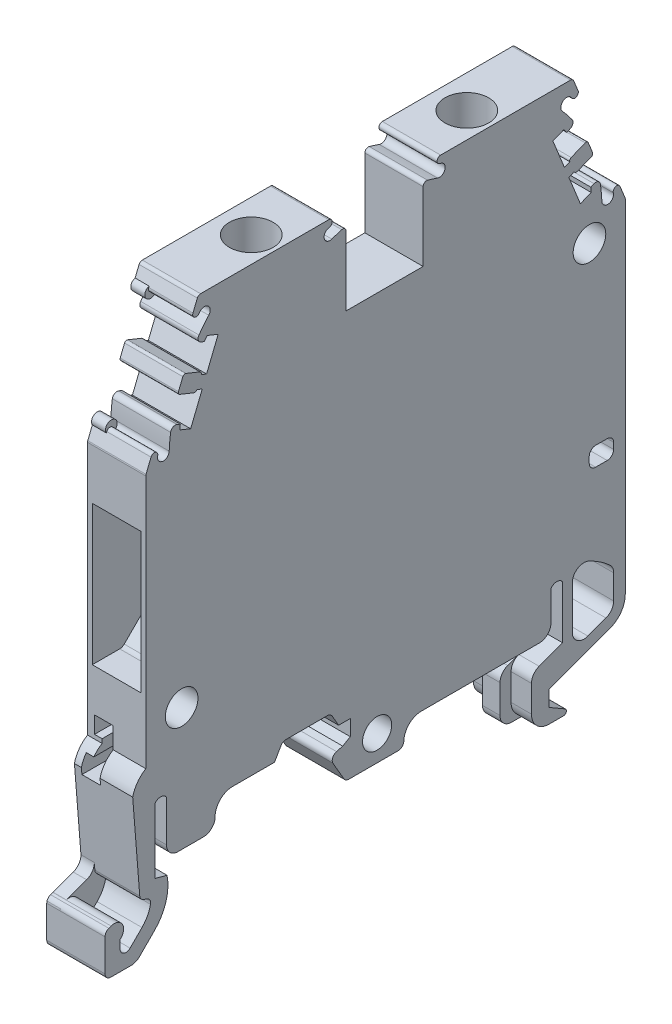
from build123d import *

# Parameters (mm, degrees)
EXTRUDE1_DEPTH      = 5
EXTRUDE2_DEPTH      = 5
SKETCH3_R           = 1.4
EXTRUDE3_DEPTH      = 2.3
SKETCH4_R           = 1.4
EXTRUDE4_DEPTH      = 3.5
EXTRUDE5_DEPTH      = 1.15
EXTRUDE6_DEPTH      = 5
EXTRUDE6_DEPTH_BACK = 5
SKETCH6_R           = 1.25
EXTRUDE7_DEPTH      = 4
EXTRUDE8_DEPTH      = 1.5
SKETCH11_R          = 0.5
EXTRUDE9_DEPTH      = 1.2
SKETCH12_R          = 0.5
EXTRUDE10_DEPTH     = 1.2
SKETCH13_R          = 0.5
EXTRUDE11_DEPTH     = 1.2
SKETCH14_R          = 0.5
EXTRUDE12_DEPTH     = 1.2
EXTRUDE13_DEPTH     = 4.17
EXTRUDE14_DEPTH     = 4.17
EXTRUDE15_DEPTH     = 16.5
EXTRUDE16_DEPTH     = 5.442
EXTRUDE17_START     = -16.5
EXTRUDE17_DEPTH     = 16.5
EXTRUDE18_DEPTH     = 5.588
EXTRUDE19_DEPTH     = 2


with BuildPart() as part:
    # Sketch1 → Extrude1 (new body)
    with BuildSketch(Plane(origin=(0, 0, 0), x_dir=(0, 0, -1), z_dir=(1, 0, 0))):
        with BuildLine():
            Line((-23.502, -46.95), (-21.759, -46.95))
            ThreePointArc((-21.759, -46.95), (-21.376323502, -46.873882406), (-21.051946609, -46.657053391))
            Line((-21.051946609, -46.657053391), (-19.773286438, -45.378213562))
            ThreePointArc((-19.773286438, -45.378213562), (-18.776475564, -43.718487394), (-18.675825444, -41.785046827))
            Line((-18.675825444, -41.785046827), (-19.727, -41.503053653))
            Line((-19.727, -41.503053653), (-19.727, -35.95))
            ThreePointArc((-19.727, -35.95), (-19.227, -35.681662479), (-18.727, -35.95))
            Line((-18.727, -35.95), (-18.727, -39.5))
            ThreePointArc((-18.727, -39.5), (-18.434106781, -40.207106781), (-17.727, -40.5))
            Line((-17.727, -40.5), (-15.552, -40.5))
            ThreePointArc((-15.552, -40.5), (-14.844893258, -40.20710682), (-14.552, -39.50000011))
            ThreePointArc((-14.552, -39.50000011), (-14.11266021, -38.439339867), (-13.052, -38))
            Line((-13.052, -38), (-9.452, -38))
            Line((-9.452, -38), (-8.902901044, -37.049828765))
            ThreePointArc((-8.902901044, -37.049828765), (-8.719910326, -36.866935534), (-8.47, -36.8))
            Line((-8.47, -36.8), (-4.933, -36.8))
            ThreePointArc((-4.933, -36.8), (-4.682918753, -36.867034219), (-4.49990159, -37.050170601))
            Line((-4.49990159, -37.050170601), (-3.952, -38))
            Line((-3.952, -38), (-2.952, -38))
            Line((-2.952, -38), (-2.952, -39.35))
            Line((-2.952, -39.35), (-3.601, -39.725))
            Line((-3.601, -39.725), (-4.131380251, -39.867101879))
            ThreePointArc((-4.131380251, -39.867101879), (-4.451749021, -40.131537658), (-4.461349102, -40.546833057))
            Line((-4.461349102, -40.546833057), (-3.465738735, -42.253167119))
            ThreePointArc((-3.465738735, -42.253167119), (-3.289876782, -42.398074471), (-3.068, -42.45))
            Line((-3.068, -42.45), (1.149, -42.45))
            ThreePointArc((1.149, -42.45), (1.498078474, -42.307972386), (1.648656374, -41.96249602))
            ThreePointArc((1.648656374, -41.96249602), (2.100712387, -40.926133776), (3.148, -40.5))
            Line((3.148, -40.5), (13.273, -40.5))
            ThreePointArc((13.273, -40.5), (13.980106781, -40.207106781), (14.273, -39.5))
            Line((14.273, -39.5), (14.273, -36.95))
            ThreePointArc((14.273, -36.95), (14.773, -36.681662479), (15.273, -36.95))
            Line((15.273, -36.95), (15.273, -41.486346363))
            Line((15.273, -41.486346363), (13.255989928, -42.22015369))
            ThreePointArc((13.255989928, -42.22015369), (12.778878491, -42.586379946), (12.598, -43.16))
            Line((12.598, -43.16), (12.598, -45.45))
            ThreePointArc((12.598, -45.45), (13.037339828, -46.510660172), (14.098, -46.95))
            Line((14.098, -46.95), (15.355, -46.95021507))
            ThreePointArc((15.355, -46.95021507), (15.59016179, -46.769906308), (15.476857535, -46.496091658))
            Line((15.476857535, -46.496091658), (14.098, -45.7))
            Line((14.098, -45.7), (14.098, -44.35))
            Line((14.098, -44.35), (19.332020143, -42.445192621))
            ThreePointArc((19.332020143, -42.445192621), (20.286334544, -41.713109384), (20.648, -40.566))
            Line((20.648, -40.566), (20.648, -33.868))
            Line((20.648, -33.868), (20.648, -11.196))
            ThreePointArc((20.648, -11.196), (20.642503672, -11.138836653), (20.626077578, -11.083809011))
            Line((20.626077578, -11.083809011), (20.197624605, -10.022683971))
            ThreePointArc((20.197624605, -10.022683971), (19.820987714, -9.847926875), (19.622652378, -10.212698701))
            ThreePointArc((19.622652378, -10.212698701), (19.212801201, -10.833523403), (18.639374153, -10.359621812))
            ThreePointArc((18.639374153, -10.359621812), (18.594690078, -9.689254456), (18.516903495, -9.021917731))
            ThreePointArc((18.516903495, -9.021917731), (18.320756771, -8.731449516), (17.971078681, -8.707563229))
            Line((17.971078681, -8.707563229), (17.687, -8.822))
            Line((17.687, -8.822), (17.724, -9.239))
            Line((17.724, -9.239), (16.797, -9.613))
            Line((16.797, -9.613), (15.804, -7.156))
            Line((15.804, -7.156), (16.267651857, -6.969140308))
            ThreePointArc((16.267651857, -6.969140308), (16.374983416, -7.07815597), (16.527960659, -7.079718385))
            Line((16.527960659, -7.079718385), (17.732960659, -6.592718385))
            ThreePointArc((17.732960659, -6.592718385), (17.842074029, -6.485209666), (17.843718385, -6.332039341))
            Line((17.843718385, -6.332039341), (17.469218385, -5.405039341))
            ThreePointArc((17.469218385, -5.405039341), (17.362037228, -5.295852801), (17.209039341, -5.294781615))
            Line((17.209039341, -5.294781615), (16.003539341, -5.781781615))
            ThreePointArc((16.003539341, -5.781781615), (15.893890117, -5.888874697), (15.892651857, -6.042140308))
            Line((15.892651857, -6.042140308), (15.429, -6.229))
            Line((15.429, -6.229), (14.437, -3.772))
            Line((14.437, -3.772), (15.364, -3.398))
            Line((15.364, -3.398), (15.627, -3.723))
            Line((15.627, -3.723), (15.910921319, -3.607936771))
            ThreePointArc((15.910921319, -3.607936771), (16.145432429, -3.347506549), (16.084793452, -3.002336625))
            ThreePointArc((16.084793452, -3.002336625), (15.677297824, -2.468364084), (15.243982278, -1.955122426))
            ThreePointArc((15.243982278, -1.955122426), (15.32761035, -1.215969467), (16.053675323, -1.377742166))
            ThreePointArc((16.053675323, -1.377742166), (16.449502456, -1.50235045), (16.59911363, -1.115280894))
            Line((16.59911363, -1.115280894), (16.224077578, -0.187809011))
            ThreePointArc((16.224077578, -0.187809011), (16.113801078, -0.051317904), (15.946, 0))
            Line((15.946, 0), (4.802, 0.000168523))
            ThreePointArc((4.802, 0.000168523), (4.499292068, -0.283473601), (4.762649344, -0.603985521))
            ThreePointArc((4.762649344, -0.603985521), (5.184482881, -1.215474731), (4.532603107, -1.571726532))
            ThreePointArc((4.532603107, -1.571726532), (4.107788036, -1.430414682), (3.678571291, -1.303096696))
            ThreePointArc((3.678571291, -1.303096696), (3.416570771, -1.3530786), (3.298, -1.592))
            Line((3.298, -1.592), (3.298, -7.525))
            Line((3.298, -7.525), (-3.302, -7.525))
            Line((-3.302, -7.525), (-3.302, -1.592))
            ThreePointArc((-3.302, -1.592), (-3.420570771, -1.3530786), (-3.682571291, -1.303096696))
            ThreePointArc((-3.682571291, -1.303096696), (-4.111788036, -1.430414682), (-4.536603107, -1.571726532))
            ThreePointArc((-4.536603107, -1.571726532), (-5.188531896, -1.21526828), (-4.766149344, -0.603985521))
            ThreePointArc((-4.766149344, -0.603985521), (-4.502278021, -0.28369086), (-4.805, 0.000168523))
            Line((-4.805, 0.000168523), (-15.799004599, 0))
            ThreePointArc((-15.799004599, 0), (-15.966939436, -0.05141104), (-16.077577578, -0.187809011))
            Line((-16.077577578, -0.187809011), (-16.452182394, -1.115451665))
            ThreePointArc((-16.452182394, -1.115451665), (-16.302419386, -1.502390407), (-15.906675323, -1.377742166))
            ThreePointArc((-15.906675323, -1.377742166), (-15.180644491, -1.215945112), (-15.097482278, -1.955122426))
            ThreePointArc((-15.097482278, -1.955122426), (-15.531101841, -2.468119988), (-15.938293452, -3.002336625))
            ThreePointArc((-15.938293452, -3.002336625), (-15.998419199, -3.347552598), (-15.763921319, -3.607936771))
            Line((-15.763921319, -3.607936771), (-15.481, -3.723))
            Line((-15.481, -3.723), (-15.217, -3.398))
            Line((-15.217, -3.398), (-14.29, -3.772))
            Line((-14.29, -3.772), (-15.283, -6.229))
            Line((-15.283, -6.229), (-15.746511588, -6.041793376))
            ThreePointArc((-15.746511588, -6.041793376), (-15.747887679, -5.888880471), (-15.857039341, -5.781781615))
            Line((-15.857039341, -5.781781615), (-17.062039341, -5.294781615))
            ThreePointArc((-17.062039341, -5.294781615), (-17.215211978, -5.295926826), (-17.322718385, -5.405039341))
            Line((-17.322718385, -5.405039341), (-17.697218385, -6.332039341))
            ThreePointArc((-17.697218385, -6.332039341), (-17.696073174, -6.485211978), (-17.586960659, -6.592718385))
            Line((-17.586960659, -6.592718385), (-16.381460659, -7.079718385))
            ThreePointArc((-16.381460659, -7.079718385), (-16.228562574, -7.077976983), (-16.121511743, -6.968793759))
            Line((-16.121511743, -6.968793759), (-15.657, -7.156))
            Line((-15.657, -7.156), (-16.65, -9.613))
            Line((-16.65, -9.613), (-17.577, -9.239))
            Line((-17.577, -9.239), (-17.541, -8.822))
            Line((-17.541, -8.822), (-17.824078681, -8.707563229))
            ThreePointArc((-17.824078681, -8.707563229), (-18.173891829, -8.731527176), (-18.370403495, -9.021917731))
            ThreePointArc((-18.370403495, -9.021917731), (-18.448685922, -9.68920906), (-18.492874153, -10.359621812))
            ThreePointArc((-18.492874153, -10.359621812), (-19.066290307, -10.833450493), (-19.476152378, -10.212698701))
            ThreePointArc((-19.476152378, -10.212698701), (-19.674536961, -9.848075891), (-20.051124605, -10.022683971))
            Line((-20.051124605, -10.022683971), (-20.480077578, -11.083809011))
            ThreePointArc((-20.480077578, -11.083809011), (-20.496503672, -11.138836653), (-20.502, -11.196))
            Line((-20.502, -11.196), (-20.502, -32.950475182))
            ThreePointArc((-20.502, -32.950475182), (-21.218910467, -33.614801512), (-21.626651622, -34.503079194))
            Line((-21.626651622, -34.503079194), (-21.020219374, -42.157740918))
            ThreePointArc((-21.020219374, -42.157740918), (-20.90640093, -42.437743497), (-20.651880436, -42.600763131))
            Line((-20.651880436, -42.600763131), (-20.454295239, -42.654018543))
            ThreePointArc((-20.454295239, -42.654018543), (-20.157922051, -42.875356028), (-20.094649934, -43.239806282))
            ThreePointArc((-20.094649934, -43.239806282), (-20.362523433, -43.970247397), (-20.827405845, -44.594094155))
            Line((-20.827405845, -44.594094155), (-21.848223305, -45.614776695))
            ThreePointArc((-21.848223305, -45.614776695), (-22.393244232, -45.722980172), (-22.702, -45.261))
            Line((-22.702, -45.261), (-22.702, -44.5344998))
            ThreePointArc((-22.702, -44.5344998), (-22.504572039, -43.518088991), (-23.47540146, -43.158145985))
            Line((-23.47540146, -43.158145985), (-23.673005036, -43.230076845))
            ThreePointArc((-23.673005036, -43.230076845), (-23.911560755, -43.413189973), (-24.002, -43.7))
            Line((-24.002, -43.7), (-24.002, -46.45))
            ThreePointArc((-24.002, -46.45), (-23.855553391, -46.803553391), (-23.502, -46.95))
        make_face()
    extrude(amount=EXTRUDE1_DEPTH)

    # Sketch2 → Extrude2 (cut)
    with BuildSketch(Plane(origin=(5, 0, 0), x_dir=(0, 0, -1), z_dir=(1, 0, 0))):
        with BuildLine():
            Line((16.1, -37.442), (16.1, -41.126))
            ThreePointArc((16.1, -41.126), (16.526428221, -41.945155306), (17.442010072, -42.06584631))
            Line((17.442010072, -42.06584631), (18.992010072, -41.50184631))
            ThreePointArc((18.992010072, -41.50184631), (19.469121509, -41.135620054), (19.65, -40.562))
            Line((19.65, -40.562), (19.65, -38.47))
            ThreePointArc((19.65, -38.47), (19.565155982, -38.0669001), (19.324992263, -37.732222009))
            ThreePointArc((19.324992263, -37.732222009), (18.467464008, -37.06238585), (17.516646463, -36.533253368))
            ThreePointArc((17.516646463, -36.533253368), (16.559918087, -36.600387539), (16.1, -37.442))
        make_face()
    extrude(amount=-EXTRUDE2_DEPTH, mode=Mode.SUBTRACT)

    # Sketch3 → Extrude3 (cut)
    with BuildSketch(Plane(origin=(5, 0, 0), x_dir=(0, 0, -1), z_dir=(1, 0, 0))):
        with Locations((-17.425, -29.947)):
            Circle(SKETCH3_R)
    extrude(amount=-EXTRUDE3_DEPTH, mode=Mode.SUBTRACT)

    # Sketch4 → Extrude4 (cut)
    with BuildSketch(Plane(origin=(5, 0, 0), x_dir=(0, 0, -1), z_dir=(1, 0, 0))):
        with Locations((17.575, -12.947)):
            Circle(SKETCH4_R)
    extrude(amount=-EXTRUDE4_DEPTH, mode=Mode.SUBTRACT)

    # Sketch5 → Extrude5 (add)
    with BuildSketch(Plane(origin=(0, 0, 0), x_dir=(0, 0, -1), z_dir=(1, 0, 0))):
        with BuildLine():
            Line((-23.502, -46.95), (-21.759, -46.95))
            ThreePointArc((-21.759, -46.95), (-21.376323502, -46.873882406), (-21.051946609, -46.657053391))
            Line((-21.051946609, -46.657053391), (-19.773286438, -45.378213562))
            ThreePointArc((-19.773286438, -45.378213562), (-18.776475564, -43.718487394), (-18.675825444, -41.785046827))
            Line((-18.675825444, -41.785046827), (-19.552, -41.55))
            Line((-19.552, -41.55), (-21.070122506, -41.503036329))
            ThreePointArc((-21.070122506, -41.503036329), (-21.225853729, -42.122807696), (-21.724989928, -42.52184631))
            Line((-21.724989928, -42.52184631), (-23.672857976, -43.230098387))
            ThreePointArc((-23.672857976, -43.230098387), (-23.911529606, -43.413145504), (-24.002, -43.7))
            Line((-24.002, -43.7), (-24.002, -46.45))
            ThreePointArc((-24.002, -46.45), (-23.855553391, -46.803553391), (-23.502, -46.95))
        make_face()
    extrude(amount=EXTRUDE5_DEPTH)

    # Sketch6 → Extrude6 (cut, two sides: drawn at the far end of the back side and taken through both)
    with BuildSketch(Plane(origin=(5, 0, 0), x_dir=(0, 0, -1), z_dir=(1, 0, 0)).offset(-EXTRUDE6_DEPTH_BACK)):
        with Locations((-0.65, -40.25)):
            Circle(SKETCH6_R)
    extrude(amount=EXTRUDE6_DEPTH + EXTRUDE6_DEPTH_BACK, mode=Mode.SUBTRACT)

    # Sketch7 → Extrude7 (cut)
    with BuildSketch(Plane(origin=(5, 0, 0), x_dir=(0, 0, -1), z_dir=(1, 0, 0))):
        with BuildLine():
            Line((18.106, -29.847), (19.1, -29.847))
            ThreePointArc((19.1, -29.847), (19.48890873, -29.68590873), (19.65, -29.297))
            Line((19.65, -29.297), (19.65, -28.772))
            ThreePointArc((19.65, -28.772), (19.48890873, -28.38309127), (19.1, -28.222))
            Line((19.1, -28.222), (18.106, -28.222))
            ThreePointArc((18.106, -28.222), (17.71709127, -28.38309127), (17.556, -28.772))
            Line((17.556, -28.772), (17.556, -29.297))
            ThreePointArc((17.556, -29.297), (17.71709127, -29.68590873), (18.106, -29.847))
        make_face()
    extrude(amount=-EXTRUDE7_DEPTH, mode=Mode.SUBTRACT)

    # Sketch8 → Extrude8 (add)
    with BuildSketch(Plane(origin=(1.75, 0, 0), x_dir=(0, 0, -1), z_dir=(1, 0, 0))):
        with BuildLine():
            Line((12.648, -46.95), (14.2, -46.95))
            Line((14.2, -46.95), (14.2, -41.949558739))
            Line((14.2, -41.949558739), (14, -41.949558739))
            Line((14, -41.949558739), (12.305989928, -42.56615369))
            ThreePointArc((12.305989928, -42.56615369), (11.828878491, -42.932379946), (11.648, -43.506))
            Line((11.648, -43.506), (11.648, -45.95))
            ThreePointArc((11.648, -45.95), (11.940893219, -46.657106781), (12.648, -46.95))
        make_face()
    extrude(amount=EXTRUDE8_DEPTH)

    # Sketch9 → Cut-Revolve1 (revolve, cut)
    with BuildSketch(Plane(origin=(2.8, 0, 0), x_dir=(0, 0, -1), z_dir=(1, 0, 0))):
        Polygon((9.25, 1), (11.125, 1), (11.125, -11.05), (10.665, -11.05), (10.665, -14), (9.25, -14), align=None)
    revolve(axis=Axis((2.8, -14, -9.25), (0, 1, 0)), mode=Mode.SUBTRACT)

    # Sketch10 → Cut-Revolve2 (revolve, cut)
    with BuildSketch(Plane(origin=(2.8, 0, 0), x_dir=(0, 0, -1), z_dir=(1, 0, 0))):
        Polygon((-9.25, 1), (-7.375, 1), (-7.375, -11.05), (-7.835, -11.05), (-7.835, -14), (-9.25, -14), align=None)
    revolve(axis=Axis((2.8, -14, 9.25), (0, 1, 0)), mode=Mode.SUBTRACT)

    # Sketch11 → Extrude9 (add)
    with BuildSketch(Plane(origin=(0, 0, 0), x_dir=(0, 0, -1), z_dir=(1, 0, 0))):
        with Locations((-16.29, -1.51)):
            Circle(SKETCH11_R)
    extrude(amount=EXTRUDE9_DEPTH)

    # Sketch12 → Extrude10 (add)
    with BuildSketch(Plane(origin=(0, 0, 0), x_dir=(0, 0, -1), z_dir=(1, 0, 0))):
        with Locations((16.44, -1.51)):
            Circle(SKETCH12_R)
    extrude(amount=EXTRUDE10_DEPTH)

    # Sketch13 → Extrude11 (add)
    with BuildSketch(Plane(origin=(0, 0, 0), x_dir=(0, 0, -1), z_dir=(1, 0, 0))):
        with Locations((19.81, -9.85)):
            Circle(SKETCH13_R)
    extrude(amount=EXTRUDE11_DEPTH)

    # Sketch14 → Extrude12 (add)
    with BuildSketch(Plane(origin=(0, 0, 0), x_dir=(0, 0, -1), z_dir=(1, 0, 0))):
        with Locations((-19.66, -9.85)):
            Circle(SKETCH14_R)
    extrude(amount=EXTRUDE12_DEPTH)

    # Sketch15 → Extrude13 (cut)
    with BuildSketch(Plane(origin=(0.41, 0, 0), x_dir=(0, 0, -1), z_dir=(1, 0, 0))):
        with BuildLine():
            Line((14.48, -18.96), (14.48, -24.08))
            Line((14.48, -24.08), (17.75890873, -27.35890873))
            ThreePointArc((17.75890873, -27.35890873), (17.937341572, -27.478133743), (18.147817459, -27.52))
            Line((18.147817459, -27.52), (20.65, -27.52))
            Line((20.65, -27.52), (20.65, -15.52))
            Line((20.65, -15.52), (18.147817459, -15.52))
            ThreePointArc((18.147817459, -15.52), (17.937341572, -15.561866257), (17.75890873, -15.68109127))
            Line((17.75890873, -15.68109127), (14.48, -18.96))
        make_face()
    extrude(amount=EXTRUDE13_DEPTH, mode=Mode.SUBTRACT)

    # Sketch16 → Extrude14 (cut)
    with BuildSketch(Plane(origin=(0.41, 0, 0), x_dir=(0, 0, -1), z_dir=(1, 0, 0))):
        with BuildLine():
            Line((-20.65, -15.52), (-20.65, -27.52))
            Line((-20.65, -27.52), (-18.147817459, -27.52))
            ThreePointArc((-18.147817459, -27.52), (-17.937341572, -27.478133743), (-17.75890873, -27.35890873))
            Line((-17.75890873, -27.35890873), (-14.48, -24.08))
            Line((-14.48, -24.08), (-14.48, -18.96))
            Line((-14.48, -18.96), (-17.75890873, -15.68109127))
            ThreePointArc((-17.75890873, -15.68109127), (-17.937341572, -15.561866257), (-18.147817459, -15.52))
            Line((-18.147817459, -15.52), (-20.65, -15.52))
        make_face()
    extrude(amount=EXTRUDE14_DEPTH, mode=Mode.SUBTRACT)

    # Sketch17 → Extrude15 (cut)
    with BuildSketch(Plane.XY.offset(-22)):
        with BuildLine():
            Line((1.65, -22.57), (4.09, -22.57))
            ThreePointArc((4.09, -22.57), (4.443553391, -22.423553391), (4.59, -22.07))
            Line((4.59, -22.07), (4.59, -19.7))
            ThreePointArc((4.59, -19.7), (4.443553391, -19.346446609), (4.09, -19.2))
            Line((4.09, -19.2), (1.65, -19.2))
            ThreePointArc((1.65, -19.2), (1.296446609, -19.346446609), (1.15, -19.7))
            Line((1.15, -19.7), (1.15, -22.07))
            ThreePointArc((1.15, -22.07), (1.296446609, -22.423553391), (1.65, -22.57))
        make_face()
    extrude(amount=EXTRUDE15_DEPTH, mode=Mode.SUBTRACT)

    # Sketch18 → Extrude16 (cut)
    with BuildSketch(Plane.XY.offset(-22)):
        Polygon((0.6, -31.15), (0.6, -32.6), (1.25, -32.6), (1.25, -33.6), (0.6, -33.6), (0.6, -35.05), (2.2, -35.05), (2.2, -31.15), align=None)
    extrude(amount=EXTRUDE16_DEPTH, mode=Mode.SUBTRACT)

    # Sketch19 → Extrude17 (cut)
    with BuildSketch(Plane.XY.offset(22).offset(EXTRUDE17_START)):
        with BuildLine():
            Line((1.15, -19.7), (1.15, -22.07))
            ThreePointArc((1.15, -22.07), (1.296446609, -22.423553391), (1.65, -22.57))
            Line((1.65, -22.57), (4.09, -22.57))
            ThreePointArc((4.09, -22.57), (4.443553391, -22.423553391), (4.59, -22.07))
            Line((4.59, -22.07), (4.59, -19.7))
            ThreePointArc((4.59, -19.7), (4.443553391, -19.346446609), (4.09, -19.2))
            Line((4.09, -19.2), (1.65, -19.2))
            ThreePointArc((1.65, -19.2), (1.296446609, -19.346446609), (1.15, -19.7))
        make_face()
    extrude(amount=EXTRUDE17_DEPTH, mode=Mode.SUBTRACT)

    # Sketch20 → Extrude18 (cut)
    with BuildSketch(Plane.XY.offset(22)):
        Polygon((0.6, -31.15), (0.6, -32.6), (1.25, -32.6), (1.25, -33.6), (0.6, -33.6), (0.6, -35.05), (2.2, -35.05), (2.2, -31.15), align=None)
    extrude(amount=-EXTRUDE18_DEPTH, mode=Mode.SUBTRACT)

    # Sketch21 → Extrude19 (add)
    with BuildSketch(Plane(origin=(-2, 0, 0), x_dir=(0, 0, -1), z_dir=(1, 0, 0))):
        with BuildLine():
            Line((20.63, -36.808817849), (20.63, -33.770069825))
            ThreePointArc((20.63, -33.770069825), (18.710242885, -32.765541801), (16.63, -32.159626403))
            Line((16.63, -32.159626403), (16.63, -34.587208652))
            ThreePointArc((16.63, -34.587208652), (18.781371684, -35.425469035), (20.63, -36.808817849))
        make_face()
    extrude(amount=EXTRUDE19_DEPTH)


solid = part.part
